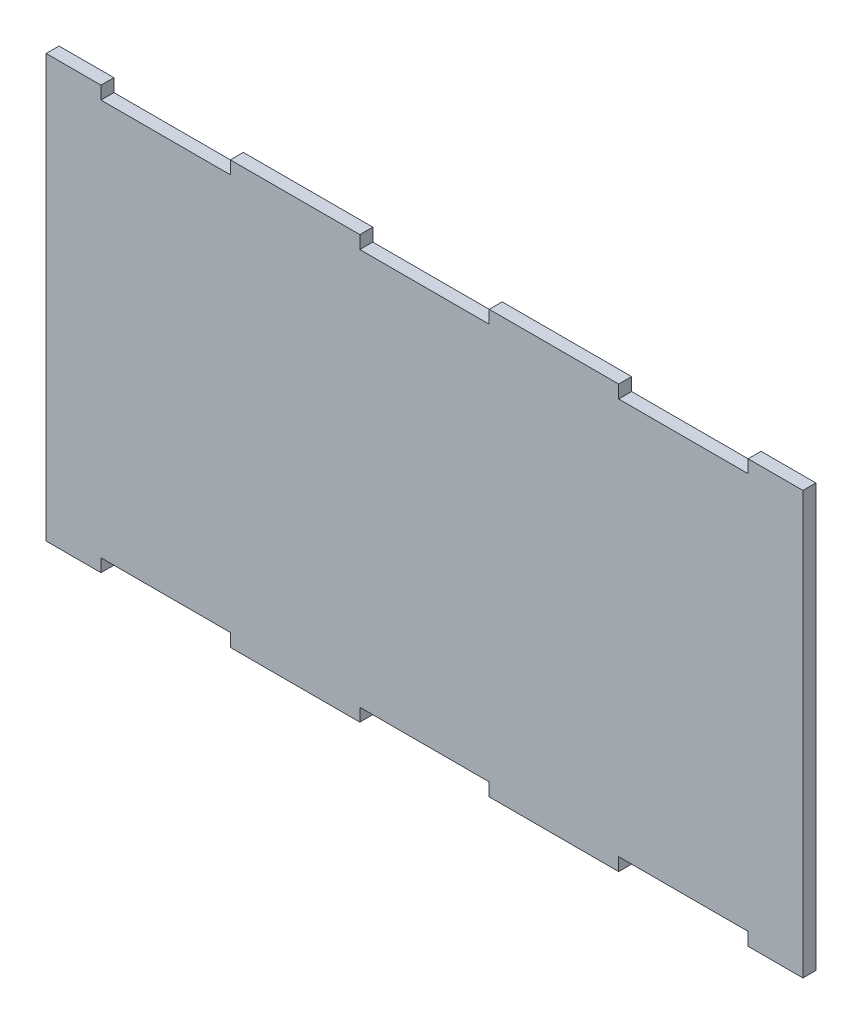
from build123d import *

# Parameters (mm, degrees)
SKETCH1_W               = 148.5265
SKETCH1_H               = 82.8675
BOSS_EXTRUDE1_DEPTH     = 2.54
SKETCH2_W               = 25.4
SKETCH2_H               = 2.54
CUT_EXTRUDE1_DEPTH      = 86.077832246
LPATTERN1_COUNT         = 3
LPATTERN1_PITCH         = 50.8
MIRROR1_COPY_1_SKETCH_W = 25.4
MIRROR1_COPY_1_SKETCH_H = 2.54
MIRROR1_COPY_1_DEPTH    = 86.077832246
MIRROR1_COPY_2_SKETCH_W = 25.4
MIRROR1_COPY_2_SKETCH_H = 2.54
MIRROR1_COPY_2_DEPTH    = 86.077832246


with BuildPart() as part:
    # Sketch1 → Boss-Extrude1 (new body)
    with BuildSketch(Plane.XY):
        Rectangle(SKETCH1_W, SKETCH1_H)
    extrude(amount=BOSS_EXTRUDE1_DEPTH)

    # Sketch2 → Cut-Extrude1 (cut, through all)
    with BuildSketch(Plane.XY.offset(2.54)):
        with Locations((50.8, 40.16375)):
            Rectangle(SKETCH2_W, SKETCH2_H)
    cut_extrude1 = extrude(amount=-CUT_EXTRUDE1_DEPTH, mode=Mode.SUBTRACT)

    # LPattern1: Cut-Extrude1 ×3
    with Locations(*[(-i * LPATTERN1_PITCH, 0, 0) for i in range(1, LPATTERN1_COUNT)]):
        add(cut_extrude1, mode=Mode.SUBTRACT)

    # Mirror1: Cut-Extrude1 across plane
    add(cut_extrude1.mirror(Plane.ZX), mode=Mode.SUBTRACT)

    # Mirror1 copy 1 sketch → Mirror1 copy 1 (cut, through all)
    with BuildSketch(Plane(origin=(-50.8, 0, 2.54), x_dir=(1, 0, 0), z_dir=(0, 0, 1))):
        with Locations((50.8, -40.16375)):
            Rectangle(MIRROR1_COPY_1_SKETCH_W, MIRROR1_COPY_1_SKETCH_H)
    extrude(amount=-MIRROR1_COPY_1_DEPTH, mode=Mode.SUBTRACT)

    # Mirror1 copy 2 sketch → Mirror1 copy 2 (cut, through all)
    with BuildSketch(Plane(origin=(-101.6, 0, 2.54), x_dir=(1, 0, 0), z_dir=(0, 0, 1))):
        with Locations((50.8, -40.16375)):
            Rectangle(MIRROR1_COPY_2_SKETCH_W, MIRROR1_COPY_2_SKETCH_H)
    extrude(amount=-MIRROR1_COPY_2_DEPTH, mode=Mode.SUBTRACT)


solid = part.part
